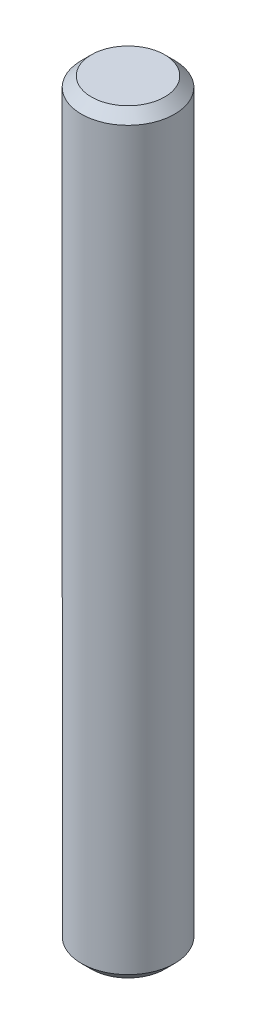
from build123d import *

# Parameters (mm, degrees)
SKETCH1_R           = 2.975
BOSS_EXTRUDE1_DEPTH = 48.26
CHAMFER1_SIZE       = 0.635


with BuildPart() as part:
    # Sketch1 → Boss-Extrude1 (new body)
    with BuildSketch(Plane(origin=(0, 0, 0), x_dir=(1, 0, 0), z_dir=(0, 1, 0))):
        with Locations(Location((0, 0, 0), (0, 0, 90))):
            Circle(SKETCH1_R)
    extrude(amount=BOSS_EXTRUDE1_DEPTH)

    # Chamfer1
    chamfer1_edges = [part.edges().sort_by_distance(p)[0] for p in [
        (0, 0, 2.975),
        (0, 48.26, 2.975),
    ]]
    chamfer(chamfer1_edges, length=CHAMFER1_SIZE)


solid = part.part
